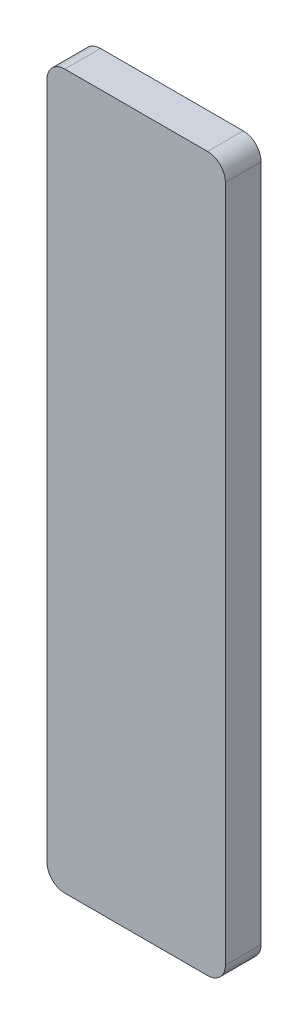
from build123d import *

# Parameters (mm, degrees)
BOSS_EXTRUDE1_DEPTH = 20


with BuildPart() as part:
    # Sketch1 → Boss-Extrude1 (new body)
    with BuildSketch(Plane.XY):
        with BuildLine():
            Line((-40, -200), (40, -200))
            ThreePointArc((40, -200), (47.071067812, -197.071067812), (50, -190))
            Line((50, -190), (50, 190))
            ThreePointArc((50, 190), (47.071067812, 197.071067812), (40, 200))
            Line((40, 200), (-40, 200))
            ThreePointArc((-40, 200), (-47.071067812, 197.071067812), (-50, 190))
            Line((-50, 190), (-50, -190))
            ThreePointArc((-50, -190), (-47.071067812, -197.071067812), (-40, -200))
        make_face()
    extrude(amount=BOSS_EXTRUDE1_DEPTH)


solid = part.part
